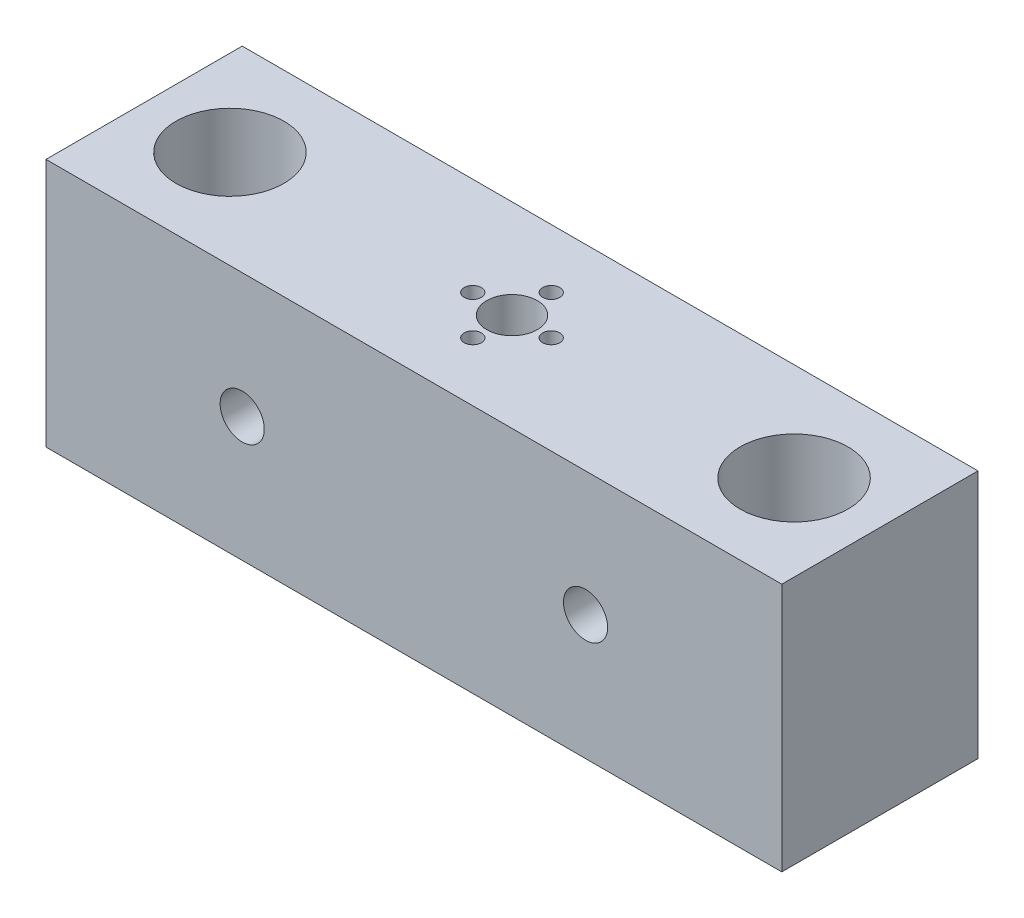
from build123d import *

# Parameters (mm, degrees)
ESBO_O1_W                            = 150
ESBO_O1_H                            = 40
RESSALTO_EXTRUS_O1_DEPTH             = 50.8
ESBO_O2_R                            = 5.15
ESBO_O2_R_2                          = 11
CORTE_EXTRUS_O1_DEPTH                = 93.766588813
ESBO_O3_R                            = 1.75
CORTE_EXTRUS_O2_DEPTH                = 93.766588813
PADR_OCIRCULAR1_COUNT                = 4
ESBO_O5_R                            = 4
CORTE_EXTRUS_O3_DEPTH                = 100.023431571
FURO_ROSCADO_DE_M10X1_01_D           = 9
FURO_ROSCADO_DE_M10X1_01_CSINK_D     = 10.05
FURO_ROSCADO_DE_M10X1_01_CSINK_ANGLE = 90


with BuildPart() as part:
    # Esboço1 → Ressalto-extrusão1 (new body)
    with BuildSketch(Plane(origin=(0, 0, 0), x_dir=(1, 0, 0), z_dir=(0, 1, 0))):
        Rectangle(ESBO_O1_W, ESBO_O1_H)
    extrude(amount=RESSALTO_EXTRUS_O1_DEPTH)

    # Esboço2 → Corte-extrusão1 (cut, through all)
    with BuildSketch(Plane(origin=(0, 50.8, 0), x_dir=(1, 0, 0), z_dir=(0, 1, 0))):
        with Locations(Location((0, 0, 0), (0, 0, 270))):
            Circle(ESBO_O2_R)
        with Locations(Location((-57.5, 0, 0), (0, 0, 270))):
            Circle(ESBO_O2_R_2)
        with Locations(Location((57.5, 0, 0), (0, 0, 270))):
            Circle(ESBO_O2_R_2)
    extrude(amount=-CORTE_EXTRUS_O1_DEPTH, mode=Mode.SUBTRACT)

    # Esboço3 → Corte-extrusão2 (cut, through all)
    with BuildSketch(Plane(origin=(0, 50.8, 0), x_dir=(1, 0, 0), z_dir=(0, 1, 0))):
        with Locations(Location((0, 8, 0), (0, 0, 270))):
            Circle(ESBO_O3_R)
    corte_extrus_o2 = extrude(amount=-CORTE_EXTRUS_O2_DEPTH, mode=Mode.SUBTRACT)

    # PadrãoCircular1: Corte-extrusão2 ×4 about axis
    padr_ocircular1_axis = Axis((0, 0, 0), (0, 1, 0))
    for i in range(1, PADR_OCIRCULAR1_COUNT):
        add(corte_extrus_o2.rotate(padr_ocircular1_axis, i * 360 / PADR_OCIRCULAR1_COUNT), mode=Mode.SUBTRACT)

    # Esboço5 → Corte-extrusão3 (cut, through all)
    with BuildSketch(Plane(origin=(0, 0, -20), x_dir=(-1, 0, 0), z_dir=(0, 0, -1))):
        with Locations((35, 25.4)):
            Circle(ESBO_O5_R)
        with Locations((-35, 25.4)):
            Circle(ESBO_O5_R)
    extrude(amount=-CORTE_EXTRUS_O3_DEPTH, mode=Mode.SUBTRACT)

    # Furo roscado de M10x1.01 (through all)
    with Locations(Plane(origin=(0, 0, -20), x_dir=(-1, 0, 0), z_dir=(0, 0, -1))):
        with Locations((35, 25.4), (-35, 25.4)):
            CounterSinkHole(FURO_ROSCADO_DE_M10X1_01_D / 2, FURO_ROSCADO_DE_M10X1_01_CSINK_D / 2, counter_sink_angle=FURO_ROSCADO_DE_M10X1_01_CSINK_ANGLE)


solid = part.part
